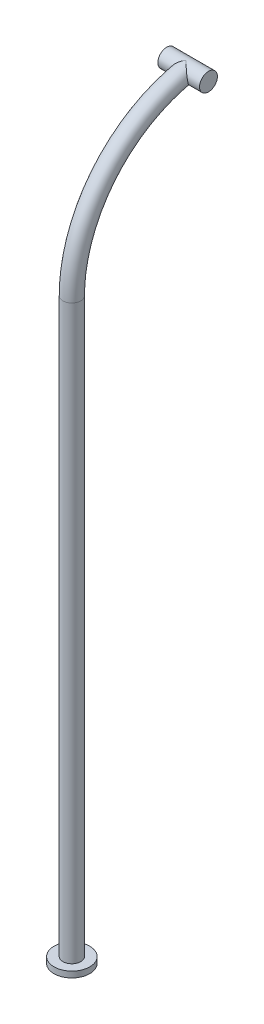
from build123d import *

# Parameters (mm, degrees)
SKETCH1_R                = 1.5
BOSS_EXTRUDE1_DEPTH      = 96
SKETCH4_R                = 3
BOSS_EXTRUDE4_DEPTH      = 1
SKETCH7_R                = 1.5
REVOLVE1_ANGLE           = 80
BOSS_EXTRUDE5_DEPTH      = 3.5
BOSS_EXTRUDE5_DEPTH_BACK = 3.5
SKETCH8_R                = 1.5


with BuildPart() as part:
    # Sketch1 → Boss-Extrude1 (new body)
    with BuildSketch(Plane(origin=(0, 0, 0), x_dir=(1, 0, 0), z_dir=(0, 1, 0))):
        Circle(SKETCH1_R)
    extrude(amount=BOSS_EXTRUDE1_DEPTH)

    # Sketch4 → Boss-Extrude4 (add)
    with BuildSketch(Plane.XZ):
        Circle(SKETCH4_R)
    extrude(amount=BOSS_EXTRUDE4_DEPTH)

    # Sketch7 → Revolve1 (revolve)
    with BuildSketch(Plane(origin=(0, 96, 0), x_dir=(1, 0, 0), z_dir=(0, 1, 0))):
        Circle(SKETCH7_R)
    revolve(axis=Axis((-42.510122648, 96, -23.5), (-1, 0, 0)), revolution_arc=REVOLVE1_ANGLE)

    # Sketch8 → Boss-Extrude5 (add, two sides: drawn at the far end of the back side and taken through both)
    with BuildSketch(Plane(origin=(0, 0, 0), x_dir=(0, 0, -1), z_dir=(1, 0, 0)).offset(-BOSS_EXTRUDE5_DEPTH_BACK)):
        with Locations((19.419267825, 119.142982196)):
            Circle(SKETCH8_R)
    extrude(amount=BOSS_EXTRUDE5_DEPTH + BOSS_EXTRUDE5_DEPTH_BACK)


solid = part.part
